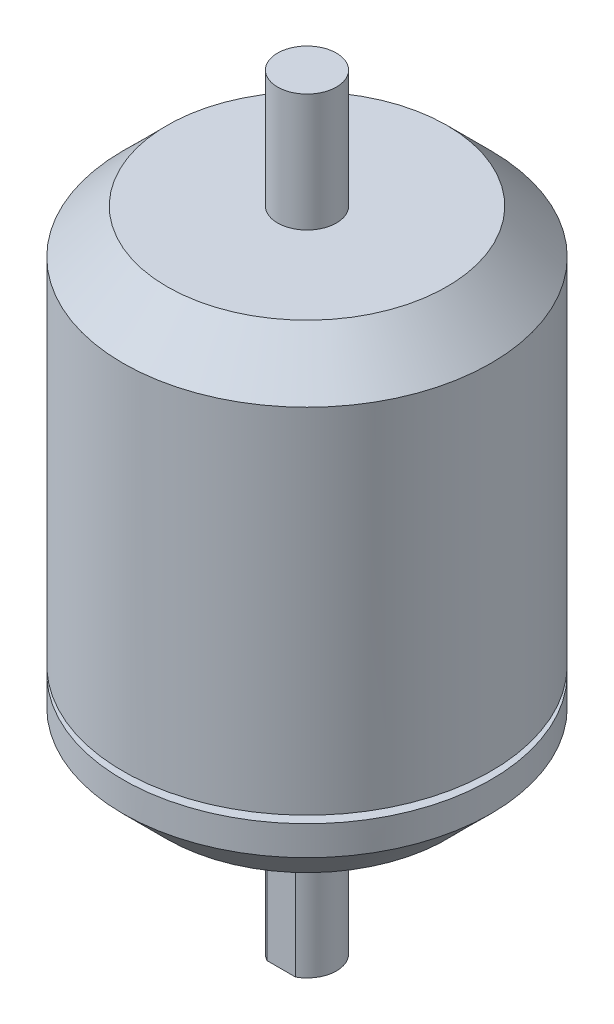
from build123d import *

# Parameters (mm, degrees)
SKETCH1_R           = 25
BOSS_EXTRUDE1_DEPTH = 65
CHAMFER1_SIZE       = 6
SKETCH2_R           = 4
BOSS_EXTRUDE2_DEPTH = 16
BOSS_EXTRUDE3_START = 23
SKETCH4_R           = 4
BOSS_EXTRUDE3_DEPTH = 23
CUT_EXTRUDE4_DEPTH  = 20
SKETCH6_R           = 2
CUT_EXTRUDE5_DEPTH  = 20
CUT_EXTRUDE6_START  = -10
SKETCH7_R           = 25
SKETCH7_R_2         = 10
CUT_EXTRUDE6_DEPTH  = 1


with BuildPart() as part:
    # Sketch1 → Boss-Extrude1 (new body)
    with BuildSketch(Plane(origin=(0, 0, 0), x_dir=(1, 0, 0), z_dir=(0, 1, 0))):
        with Locations(Location((0, 0, 0), (0, 0, 270))):
            Circle(SKETCH1_R)
    extrude(amount=BOSS_EXTRUDE1_DEPTH)

    # Chamfer1
    chamfer1_edges = [part.edges().sort_by_distance(p)[0] for p in [
        (0, 0, -25),
        (0, 65, -25),
    ]]
    chamfer(chamfer1_edges, length=CHAMFER1_SIZE)

    # Sketch2 → Boss-Extrude2 (add)
    with BuildSketch(Plane(origin=(0, 65, 0), x_dir=(1, 0, 0), z_dir=(0, 1, 0))):
        with Locations(Location((0, 0, 0), (0, 0, 270))):
            Circle(SKETCH2_R)
    extrude(amount=BOSS_EXTRUDE2_DEPTH)

    # Sketch4 → Boss-Extrude3 (add)
    with BuildSketch(Plane.XZ.offset(BOSS_EXTRUDE3_START)):
        with Locations(Location((0, 0, 0), (0, 0, 90))):
            Circle(SKETCH4_R)
    extrude(amount=-BOSS_EXTRUDE3_DEPTH)

    # Sketch5 → Cut-Extrude4 (cut)
    with BuildSketch(Plane.XZ.offset(23)):
        with BuildLine():
            Line((-1.936491673, 3.5), (1.936491673, 3.5))
            ThreePointArc((1.936491673, 3.5), (0, 4), (-1.936491673, 3.5))
        make_face()
    extrude(amount=-CUT_EXTRUDE4_DEPTH, mode=Mode.SUBTRACT)

    # Sketch6 → Cut-Extrude5 (cut)
    with BuildSketch(Plane(origin=(0, 0, 0), x_dir=(-1, 0, 0), z_dir=(0, -1, 0))):
        with Locations(Location((15, 0, 0), (0, 0, 90))):
            Circle(SKETCH6_R)
        with Locations(Location((0, -15, 0), (0, 0, 90))):
            Circle(SKETCH6_R)
        with Locations(Location((-15, 0, 0), (0, 0, 90))):
            Circle(SKETCH6_R)
        with Locations(Location((0, 15, 0), (0, 0, 90))):
            Circle(SKETCH6_R)
    extrude(amount=-CUT_EXTRUDE5_DEPTH, mode=Mode.SUBTRACT)

    # Sketch7 → Cut-Extrude6 (cut)
    with BuildSketch(Plane.XZ.offset(CUT_EXTRUDE6_START)):
        with Locations(Location((0, 0, 0), (0, 0, 270))):
            Circle(SKETCH7_R)
        with Locations(Location((0, 0, 0), (0, 0, 270))):
            Circle(SKETCH7_R_2, mode=Mode.SUBTRACT)
    extrude(amount=-CUT_EXTRUDE6_DEPTH, mode=Mode.SUBTRACT)


solid = part.part
